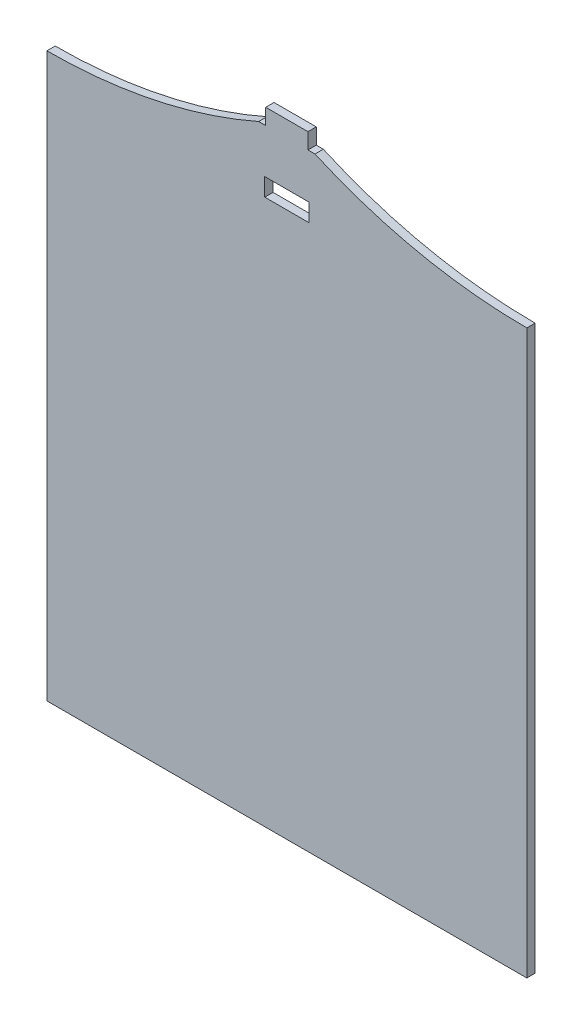
from build123d import *

# Parameters (mm, degrees)
SKETCH1_W           = 15.7
SKETCH1_H           = 6.33
BOSS_EXTRUDE1_DEPTH = 2.95


with BuildPart() as part:
    # Sketch1 → Boss-Extrude1 (new body)
    with BuildSketch(Plane.XY):
        with BuildLine():
            Line((-56.418907266, 103.171587302), (-53.918907266, 103.171587302))
            Line((-53.918907266, 103.171587302), (-53.918907266, 108.801587302))
            Line((-53.918907266, 108.801587302), (-38.918907266, 108.801587302))
            Line((-38.918907266, 108.801587302), (-38.918907266, 103.171587302))
            Line((-38.918907266, 103.171587302), (-36.418907266, 103.171587302))
            ThreePointArc((-36.418907266, 103.171587302), (0.378461485, 91.312248832), (38.831092734, 87.301587302))
            Line((38.831092734, 87.301587302), (38.831092734, -112.698412698))
            Line((38.831092734, -112.698412698), (-131.668907266, -112.698412698))
            Line((-131.668907266, -112.698412698), (-131.668907266, 87.301587302))
            ThreePointArc((-131.668907266, 87.301587302), (-93.216276016, 91.312248832), (-56.418907266, 103.171587302))
        make_face()
        with Locations((-46.418907266, 84.136587302)):
            Rectangle(SKETCH1_W, SKETCH1_H, mode=Mode.SUBTRACT)
    extrude(amount=BOSS_EXTRUDE1_DEPTH)


solid = part.part
